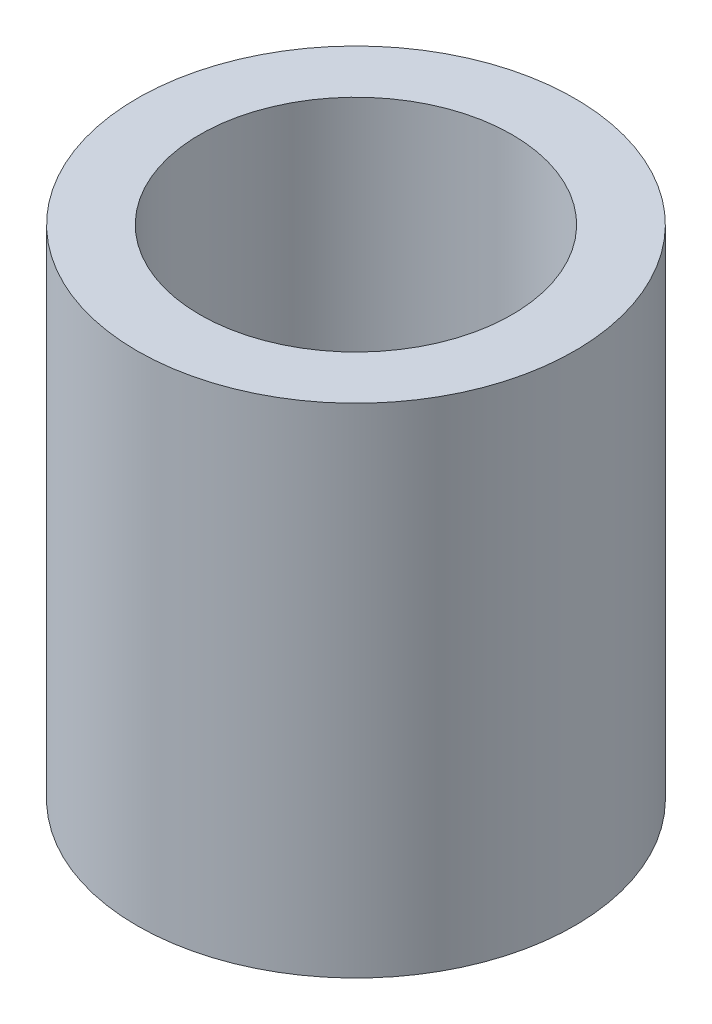
from build123d import *

# Parameters (mm, degrees)
SKETCH1_R           = 5.58165
SKETCH1_R_2         = 3.98145
BOSS_EXTRUDE1_DEPTH = 12.7


with BuildPart() as part:
    # Sketch1 → Boss-Extrude1 (new body)
    with BuildSketch(Plane(origin=(0, 0, 0), x_dir=(1, 0, 0), z_dir=(0, 1, 0))):
        with Locations(Location((0, 0, 0), (0, 0, 270))):
            Circle(SKETCH1_R)
        with Locations(Location((0, 0, 0), (0, 0, 270))):
            Circle(SKETCH1_R_2, mode=Mode.SUBTRACT)
    extrude(amount=BOSS_EXTRUDE1_DEPTH)


solid = part.part
